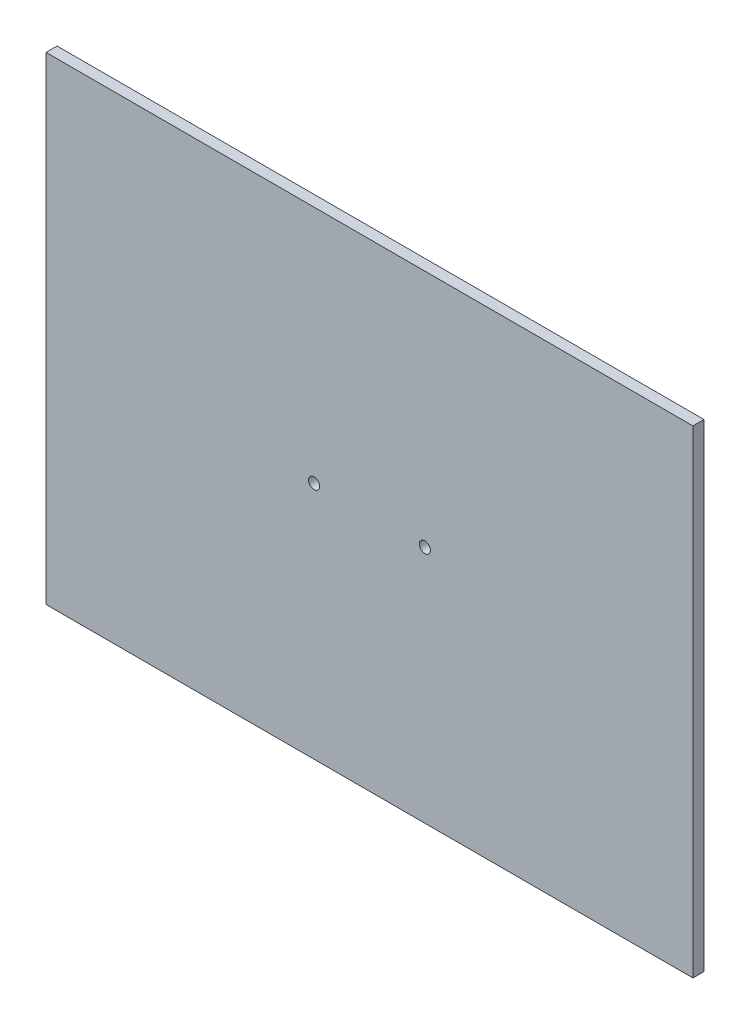
from build123d import *

# Parameters (mm, degrees)
SKETCH1_W           = 292.1
SKETCH1_H           = 215.9
BOSS_EXTRUDE1_DEPTH = 5
SKETCH2_R           = 2.5
CUT_EXTRUDE1_DEPTH  = 5


with BuildPart() as part:
    # Sketch1 → Boss-Extrude1 (new body)
    with BuildSketch(Plane.XY):
        Rectangle(SKETCH1_W, SKETCH1_H)
    extrude(amount=BOSS_EXTRUDE1_DEPTH)

    # Sketch2 → Cut-Extrude1 (cut)
    with BuildSketch(Plane(origin=(0, 0, 0), x_dir=(-1, 0, 0), z_dir=(0, 0, -1))):
        with Locations((-25, 0)):
            Circle(SKETCH2_R)
        with Locations((25, 0)):
            Circle(SKETCH2_R)
    extrude(amount=-CUT_EXTRUDE1_DEPTH, mode=Mode.SUBTRACT)


solid = part.part
